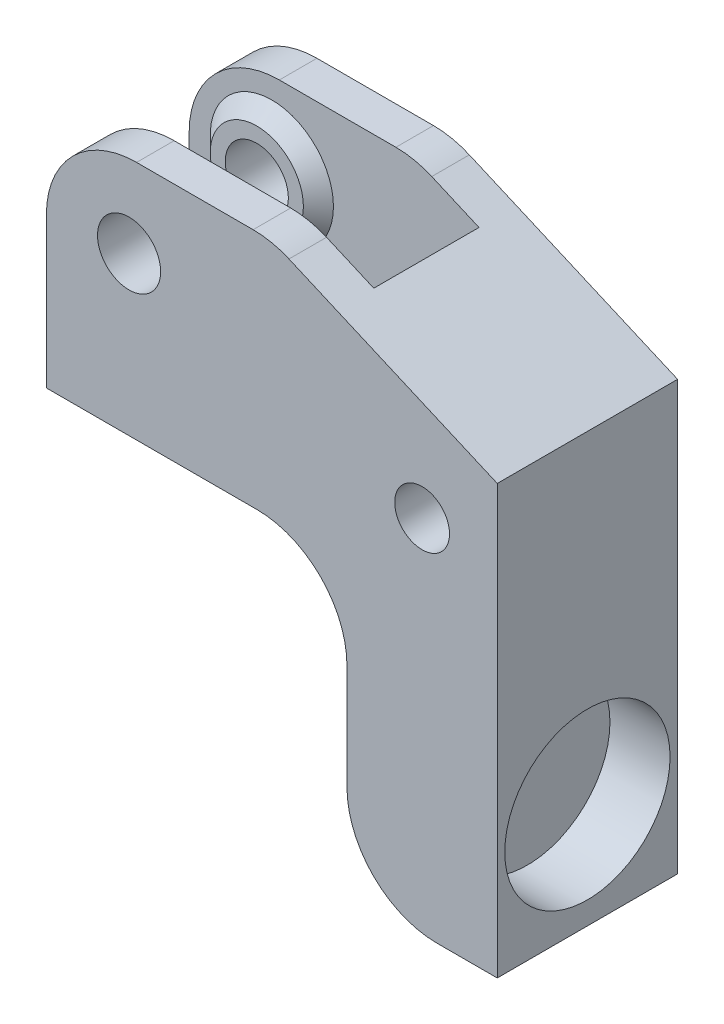
from build123d import *

# Parameters (mm, degrees)
SKETCH1_R               = 1.822216084
SKETCH1_R_2             = 2.1
BOSS_EXTRUDE1_DEPTH     = 12
FILLET1_R               = 6
CUT_EXTRUDE1_DEPTH      = 3.5
CUT_EXTRUDE1_DEPTH_BACK = 3.5
SKETCH5_R               = 5.5
CUT_EXTRUDE2_DEPTH      = 4


with BuildPart() as part:
    # Sketch1 → Boss-Extrude1 (new body)
    with BuildSketch(Plane.XY):
        Polygon((15, 16), (30, 9.5), (30, -19), (20, -19), (20, 0), (0, 0), (0, 16), align=None)
        with Locations((25, 5)):
            Circle(SKETCH1_R, mode=Mode.SUBTRACT)
        with Locations((5.5, 10.5)):
            Circle(SKETCH1_R_2, mode=Mode.SUBTRACT)
    extrude(amount=BOSS_EXTRUDE1_DEPTH)

    # Fillet1
    fillet1_edges = [part.edges().sort_by_distance(p)[0] for p in [
        (0, 16, 6),
        (15, 16, 6),
        (20, -19, 6),
        (20, 0, 6),
    ]]
    fillet(fillet1_edges, radius=FILLET1_R)

    # Sketch2 → Cut-Extrude1 (cut, two sides: drawn at the far end of the back side and taken through both)
    with BuildSketch(Plane(origin=(0, 0, 6), x_dir=(-1, 0, 0), z_dir=(0, 0, -1)).offset(-CUT_EXTRUDE1_DEPTH_BACK)):
        Polygon((-22, 18.66922052), (-12, 2), (0, 2), (0, 22), align=None)
    extrude(amount=CUT_EXTRUDE1_DEPTH + CUT_EXTRUDE1_DEPTH_BACK, mode=Mode.SUBTRACT)

    # Sketch4 → Revolve1 (revolve)
    with BuildSketch(Plane(origin=(5.5, 0, 0), x_dir=(0, 0, -1), z_dir=(1, 0, 0)), mode=Mode.PRIVATE) as revolve1_sk:
        Polygon((-9.5, 12.6), (-8.5, 12.6), (-8.5, 13.6), (-9.5, 14.6), align=None)
    revolve1 = revolve(revolve1_sk.sketch.rotate(Axis((5.5, 10.5, 12), (0, 0, -1)), 90), axis=Axis((5.5, 10.5, 12), (0, 0, -1)))

    # Mirror1: Revolve1 across plane
    add(revolve1.mirror(Plane(origin=(0, 0, 6), x_dir=(1, 0, 0), z_dir=(0, 0, -1))))

    # Sketch5 → Cut-Extrude2 (cut)
    with BuildSketch(Plane(origin=(30, 0, 0), x_dir=(0, 0, -1), z_dir=(1, 0, 0))):
        with Locations((-6, -12)):
            Circle(SKETCH5_R)
    extrude(amount=-CUT_EXTRUDE2_DEPTH, mode=Mode.SUBTRACT)


solid = part.part
